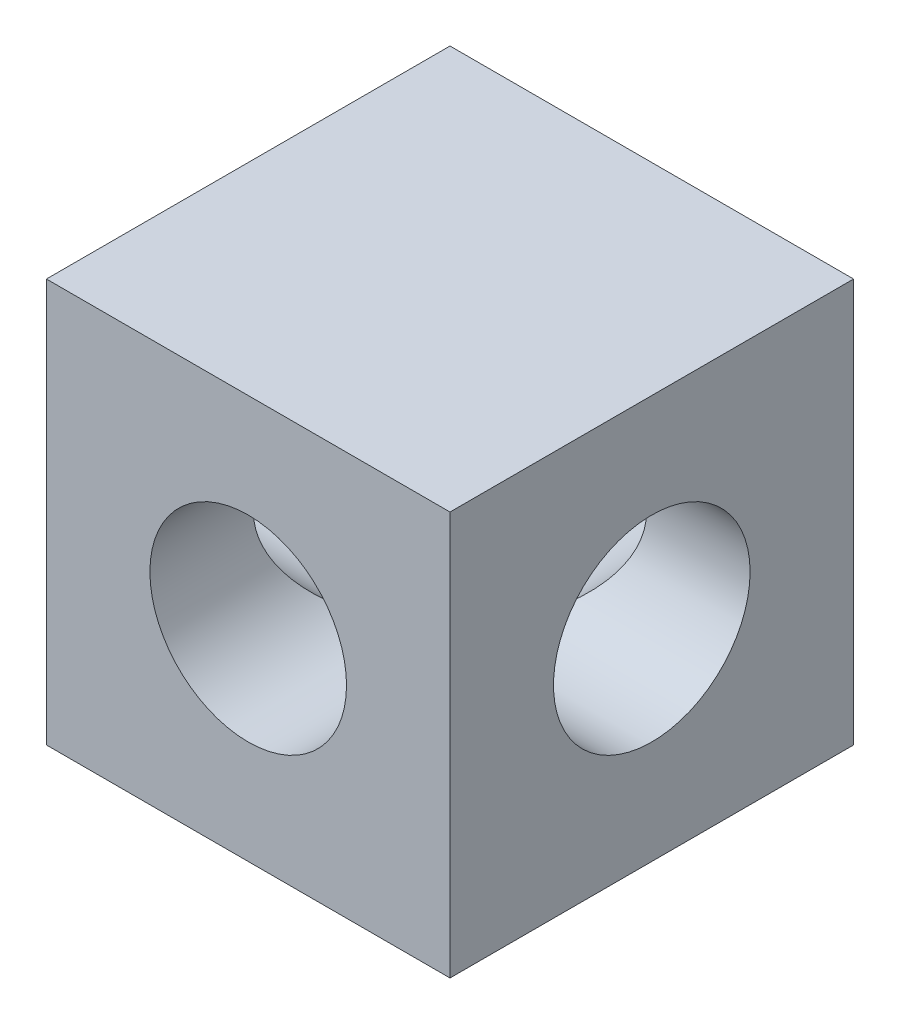
from build123d import *

# Parameters (mm, degrees)
SKETCH1_W          = 19.5
SKETCH1_H          = 19.5
SKETCH1_R          = 4.75
BASE_EXTRUDE_DEPTH = 9.75
SKETCH3_R          = 4.75
CUT_EXTRUDE1_DEPTH = 24.882524992


with BuildPart() as part:
    # Sketch1 → Base-Extrude (new, symmetric)
    with BuildSketch(Plane.XY):
        Rectangle(SKETCH1_W, SKETCH1_H)
        Circle(SKETCH1_R, mode=Mode.SUBTRACT)
    extrude(amount=BASE_EXTRUDE_DEPTH, both=True)

    # Sketch3 → Cut-Extrude1 (cut, through all)
    with BuildSketch(Plane(origin=(9.75, 0, 0), x_dir=(0, 0, -1), z_dir=(1, 0, 0))):
        Circle(SKETCH3_R)
    extrude(amount=-CUT_EXTRUDE1_DEPTH, mode=Mode.SUBTRACT)


solid = part.part
